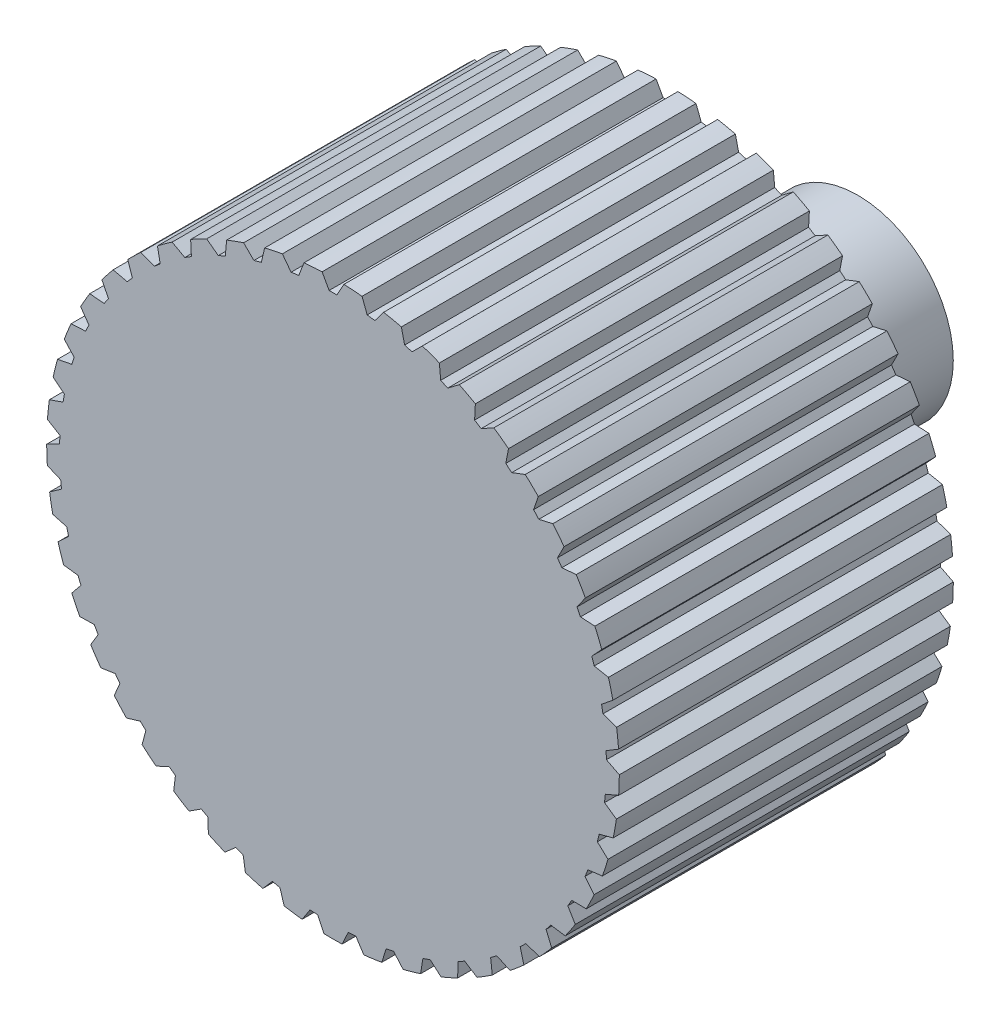
from build123d import *

# Parameters (mm, degrees)
BOSS_EXTRU_7_DEPTH = 3.5
ESQUISSE2_R        = 1
BOSS_EXTRU_8_DEPTH = 2


with BuildPart() as part:
    # Esquisse1 → Boss.-Extru.7 (new body)
    with BuildSketch(Plane.XY):
        with BuildLine():
            Line((-0.040605305, 2.865160176), (-0.114276657, 2.997822684))
            ThreePointArc((-0.114276657, 2.997822684), (-0.209269421, 2.992692151), (-0.304051754, 2.984552317))
            Line((-0.304051754, 2.984552317), (-0.35854309, 2.8429278))
            Line((-0.35854309, 2.8429278), (-0.438963363, 2.831625467))
            Line((-0.438963363, 2.831625467), (-0.530380804, 2.952743843))
            ThreePointArc((-0.530380804, 2.952743843), (-0.623735072, 2.934442802), (-0.716462144, 2.913191033))
            Line((-0.716462144, 2.913191033), (-0.750712851, 2.765361068))
            Line((-0.750712851, 2.765361068), (-0.828777499, 2.742976391))
            Line((-0.828777499, 2.742976391), (-0.936161691, 2.850193202))
            ThreePointArc((-0.936161691, 2.850193202), (-1.02606043, 2.819077862), (-1.114927414, 2.7851278))
            Line((-1.114927414, 2.7851278), (-1.12827084, 2.633969729))
            Line((-1.12827084, 2.633969729), (-1.202460424, 2.600938398))
            Line((-1.202460424, 2.600938398), (-1.323721256, 2.692166792))
            ThreePointArc((-1.323721256, 2.692166792), (-1.408414688, 2.648842779), (-1.491691889, 2.602855222))
            Line((-1.491691889, 2.602855222), (-1.483868321, 2.451311165))
            Line((-1.483868321, 2.451311165), (-1.552738824, 2.408276099))
            Line((-1.552738824, 2.408276099), (-1.685516093, 2.481740418))
            ThreePointArc((-1.685516093, 2.481740418), (-1.763355757, 2.427050983), (-1.839422279, 2.369921028))
            Line((-1.839422279, 2.369921028), (-1.810583992, 2.220940618))
            Line((-1.810583992, 2.220940618), (-1.872794929, 2.168739444))
            Line((-1.872794929, 2.168739444), (-2.014504276, 2.223009789))
            ThreePointArc((-2.014504276, 2.223009789), (-2.083975111, 2.158019401), (-2.151350406, 2.090859017))
            Line((-2.151350406, 2.090859017), (-2.102058706, 1.947341988))
            Line((-2.102058706, 1.947341988), (-2.156399211, 1.886990743))
            Line((-2.156399211, 1.886990743), (-2.304282424, 1.921010804))
            ThreePointArc((-2.304282424, 1.921010804), (-2.364032261, 1.846984426), (-2.421404945, 1.771100813))
            Line((-2.421404945, 1.771100813), (-2.352619239, 1.635840561))
            Line((-2.352619239, 1.635840561), (-2.398031635, 1.568513914))
            Line((-2.398031635, 1.568513914), (-2.549210337, 1.581621528))
            ThreePointArc((-2.549210337, 1.581621528), (-2.598076211, 1.5), (-2.644329591, 1.416870147))
            Line((-2.644329591, 1.416870147), (-2.557388713, 1.292499358))
            Line((-2.557388713, 1.292499358), (-2.592989102, 1.219507746))
            Line((-2.592989102, 1.219507746), (-2.74452077, 1.211447789))
            ThreePointArc((-2.74452077, 1.211447789), (-2.781551564, 1.12381978), (-2.815785369, 1.035061715))
            Line((-2.815785369, 1.035061715), (-2.712381526, 0.924001126))
            Line((-2.712381526, 0.924001126), (-2.737476984, 0.846765246))
            Line((-2.737476984, 0.846765246), (-2.886412228, 0.817694596))
            ThreePointArc((-2.886412228, 0.817694596), (-2.910887179, 0.725765687), (-2.932435088, 0.633106984))
            Line((-2.932435088, 0.633106984), (-2.814580917, 0.537518262))
            Line((-2.814580917, 0.537518262), (-2.828682992, 0.457541424))
            Line((-2.828682992, 0.457541424), (-2.972122955, 0.408025908))
            ThreePointArc((-2.972122955, 0.408025908), (-2.983565686, 0.31358539), (-2.992008294, 0.218829546))
            Line((-2.992008294, 0.218829546), (-2.861997693, 0.140573217))
            Line((-2.861997693, 0.140573217), (-2.864831902, 0.059412079))
            Line((-2.864831902, 0.059412079), (-2.999984689, -0.00958454))
            ThreePointArc((-2.999984689, -0.00958454), (-2.998172481, -0.10469849), (-2.993345461, -0.19970716))
            Line((-2.993345461, -0.19970716), (-2.853708938, -0.259107925))
            Line((-2.853708938, -0.259107925), (-2.845220118, -0.339873655))
            Line((-2.845220118, -0.339873655), (-2.969455134, -0.427008436))
            ThreePointArc((-2.969455134, -0.427008436), (-2.954423259, -0.520944533), (-2.936420564, -0.614356794))
            Line((-2.936420564, -0.614356794), (-2.789875986, -0.653745827))
            Line((-2.789875986, -0.653745827), (-2.770229361, -0.732544135))
            Line((-2.770229361, -0.732544135), (-2.881128513, -0.836121099))
            ThreePointArc((-2.881128513, -0.836121099), (-2.853169549, -0.927050983), (-2.822341581, -1.017048672))
            Line((-2.822341581, -1.017048672), (-2.67174127, -1.03565931))
            Line((-2.67174127, -1.03565931), (-2.641319241, -1.110956476))
            Line((-2.641319241, -1.110956476), (-2.736724002, -1.228959615))
            ThreePointArc((-2.736724002, -1.228959615), (-2.696382139, -1.31511344), (-2.653328929, -1.399944854))
            Line((-2.653328929, -1.399944854), (-2.50160415, -1.397414862))
            Line((-2.50160415, -1.397414862), (-2.460998845, -1.467745313))
            Line((-2.460998845, -1.467745313), (-2.539052272, -1.59787783))
            ThreePointArc((-2.539052272, -1.59787783), (-2.487112718, -1.67757871), (-2.432672248, -1.755592702))
            Line((-2.432672248, -1.755592702), (-2.282776151, -1.731971324))
            Line((-2.282776151, -1.731971324), (-2.232777907, -1.795966158))
            Line((-2.232777907, -1.795966158), (-2.291960777, -1.935695171))
            ThreePointArc((-2.291960777, -1.935695171), (-2.229434476, -2.007391819), (-2.164666369, -2.077069935))
            Line((-2.164666369, -2.077069935), (-2.019516511, -2.032816934))
            Line((-2.019516511, -2.032816934), (-1.961098487, -2.089230564))
            Line((-1.961098487, -2.089230564), (-2.000258873, -2.235836408))
            ThreePointArc((-2.000258873, -2.235836408), (-1.928362829, -2.298133329), (-1.854527721, -2.358119364))
            Line((-1.854527721, -2.358119364), (-1.716949278, -2.294096074))
            Line((-1.716949278, -2.294096074), (-1.651248515, -2.341830473))
            Line((-1.651248515, -2.341830473), (-1.669624205, -2.492459631))
            ThreePointArc((-1.669624205, -2.492459631), (-1.589757793, -2.544144288), (-1.5082928, -2.593270682))
            Line((-1.5082928, -2.593270682), (-1.380963581, -2.510723244))
            Line((-1.380963581, -2.510723244), (-1.309258869, -2.548849316))
            Line((-1.309258869, -2.548849316), (-1.306492201, -2.700569964))
            ThreePointArc((-1.306492201, -2.700569964), (-1.220209929, -2.740636373), (-1.132700676, -2.777946936))
            Line((-1.132700676, -2.777946936), (-1.018098999, -2.678482042))
            Line((-1.018098999, -2.678482042), (-0.941785989, -2.706257707))
            Line((-0.941785989, -2.706257707), (-0.917930812, -2.856116773))
            ThreePointArc((-0.917930812, -2.856116773), (-0.826912067, -2.883785088), (-0.735061821, -2.908553613))
            Line((-0.735061821, -2.908553613), (-0.635418278, -2.794107234))
            Line((-0.635418278, -2.794107234), (-0.555982315, -2.810991869))
            Line((-0.555982315, -2.810991869), (-0.511502945, -2.956072519))
            ThreePointArc((-0.511502945, -2.956072519), (-0.417519303, -2.970804206), (-0.323115824, -2.982548602))
            Line((-0.323115824, -2.982548602), (-0.240369863, -2.855348306))
            Line((-0.240369863, -2.855348306), (-0.159357078, -2.861013272))
            Line((-0.159357078, -2.861013272), (-0.095119254, -2.998491675))
            ThreePointArc((-0.095119254, -2.998491675), (0, -3), (0.095119254, -2.998491675))
            Line((0.095119254, -2.998491675), (0.159357078, -2.861013272))
            Line((0.159357078, -2.861013272), (0.240369863, -2.855348306))
            Line((0.240369863, -2.855348306), (0.323115824, -2.982548602))
            ThreePointArc((0.323115824, -2.982548602), (0.417519303, -2.970804206), (0.511502945, -2.956072519))
            Line((0.511502945, -2.956072519), (0.555982315, -2.810991869))
            Line((0.555982315, -2.810991869), (0.635418278, -2.794107234))
            Line((0.635418278, -2.794107234), (0.735061821, -2.908553613))
            ThreePointArc((0.735061821, -2.908553613), (0.826912067, -2.883785088), (0.917930812, -2.856116773))
            Line((0.917930812, -2.856116773), (0.941785989, -2.706257707))
            Line((0.941785989, -2.706257707), (1.018098999, -2.678482042))
            Line((1.018098999, -2.678482042), (1.132700676, -2.777946936))
            ThreePointArc((1.132700676, -2.777946936), (1.220209929, -2.740636373), (1.306492201, -2.700569964))
            Line((1.306492201, -2.700569964), (1.309258869, -2.548849316))
            Line((1.309258869, -2.548849316), (1.380963581, -2.510723244))
            Line((1.380963581, -2.510723244), (1.5082928, -2.593270682))
            ThreePointArc((1.5082928, -2.593270682), (1.589757793, -2.544144288), (1.669624205, -2.492459631))
            Line((1.669624205, -2.492459631), (1.651248515, -2.341830473))
            Line((1.651248515, -2.341830473), (1.716949278, -2.294096074))
            Line((1.716949278, -2.294096074), (1.854527721, -2.358119364))
            ThreePointArc((1.854527721, -2.358119364), (1.928362829, -2.298133329), (2.000258873, -2.235836408))
            Line((2.000258873, -2.235836408), (1.961098487, -2.089230564))
            Line((1.961098487, -2.089230564), (2.019516511, -2.032816934))
            Line((2.019516511, -2.032816934), (2.164666369, -2.077069935))
            ThreePointArc((2.164666369, -2.077069935), (2.229434476, -2.007391819), (2.291960777, -1.935695171))
            Line((2.291960777, -1.935695171), (2.232777907, -1.795966158))
            Line((2.232777907, -1.795966158), (2.282776151, -1.731971324))
            Line((2.282776151, -1.731971324), (2.432672248, -1.755592702))
            ThreePointArc((2.432672248, -1.755592702), (2.487112718, -1.67757871), (2.539052272, -1.59787783))
            Line((2.539052272, -1.59787783), (2.460998845, -1.467745313))
            Line((2.460998845, -1.467745313), (2.50160415, -1.397414862))
            Line((2.50160415, -1.397414862), (2.653328929, -1.399944854))
            ThreePointArc((2.653328929, -1.399944854), (2.696382139, -1.31511344), (2.736724002, -1.228959615))
            Line((2.736724002, -1.228959615), (2.641319241, -1.110956476))
            Line((2.641319241, -1.110956476), (2.67174127, -1.03565931))
            Line((2.67174127, -1.03565931), (2.822341581, -1.017048672))
            ThreePointArc((2.822341581, -1.017048672), (2.853169549, -0.927050983), (2.881128513, -0.836121099))
            Line((2.881128513, -0.836121099), (2.770229361, -0.732544135))
            Line((2.770229361, -0.732544135), (2.789875986, -0.653745827))
            Line((2.789875986, -0.653745827), (2.936420564, -0.614356794))
            ThreePointArc((2.936420564, -0.614356794), (2.954423259, -0.520944533), (2.969455134, -0.427008436))
            Line((2.969455134, -0.427008436), (2.845220118, -0.339873655))
            Line((2.845220118, -0.339873655), (2.853708938, -0.259107925))
            Line((2.853708938, -0.259107925), (2.993345461, -0.19970716))
            ThreePointArc((2.993345461, -0.19970716), (2.998172481, -0.10469849), (2.999984689, -0.00958454))
            Line((2.999984689, -0.00958454), (2.864831902, 0.059412079))
            Line((2.864831902, 0.059412079), (2.861997693, 0.140573217))
            Line((2.861997693, 0.140573217), (2.992008294, 0.218829546))
            ThreePointArc((2.992008294, 0.218829546), (2.983565686, 0.31358539), (2.972122955, 0.408025908))
            Line((2.972122955, 0.408025908), (2.828682992, 0.457541424))
            Line((2.828682992, 0.457541424), (2.814580917, 0.537518262))
            Line((2.814580917, 0.537518262), (2.932435088, 0.633106984))
            ThreePointArc((2.932435088, 0.633106984), (2.910887179, 0.725765687), (2.886412228, 0.817694596))
            Line((2.886412228, 0.817694596), (2.737476984, 0.846765246))
            Line((2.737476984, 0.846765246), (2.712381526, 0.924001126))
            Line((2.712381526, 0.924001126), (2.815785369, 1.035061715))
            ThreePointArc((2.815785369, 1.035061715), (2.781551564, 1.12381978), (2.74452077, 1.211447789))
            Line((2.74452077, 1.211447789), (2.592989102, 1.219507746))
            Line((2.592989102, 1.219507746), (2.557388713, 1.292499358))
            Line((2.557388713, 1.292499358), (2.644329591, 1.416870147))
            ThreePointArc((2.644329591, 1.416870147), (2.598076211, 1.5), (2.549210337, 1.581621528))
            Line((2.549210337, 1.581621528), (2.398031635, 1.568513914))
            Line((2.398031635, 1.568513914), (2.352619239, 1.635840561))
            Line((2.352619239, 1.635840561), (2.421404945, 1.771100813))
            ThreePointArc((2.421404945, 1.771100813), (2.364032261, 1.846984426), (2.304282424, 1.921010804))
            Line((2.304282424, 1.921010804), (2.156399211, 1.886990743))
            Line((2.156399211, 1.886990743), (2.102058706, 1.947341988))
            Line((2.102058706, 1.947341988), (2.151350406, 2.090859017))
            ThreePointArc((2.151350406, 2.090859017), (2.083975111, 2.158019401), (2.014504276, 2.223009789))
            Line((2.014504276, 2.223009789), (1.872794929, 2.168739444))
            Line((1.872794929, 2.168739444), (1.810583992, 2.220940618))
            Line((1.810583992, 2.220940618), (1.839422279, 2.369921028))
            ThreePointArc((1.839422279, 2.369921028), (1.763355757, 2.427050983), (1.685516093, 2.481740418))
            Line((1.685516093, 2.481740418), (1.552738824, 2.408276099))
            Line((1.552738824, 2.408276099), (1.483868321, 2.451311165))
            Line((1.483868321, 2.451311165), (1.491691889, 2.602855222))
            ThreePointArc((1.491691889, 2.602855222), (1.408414688, 2.648842779), (1.323721256, 2.692166792))
            Line((1.323721256, 2.692166792), (1.202460424, 2.600938398))
            Line((1.202460424, 2.600938398), (1.12827084, 2.633969729))
            Line((1.12827084, 2.633969729), (1.114927414, 2.7851278))
            ThreePointArc((1.114927414, 2.7851278), (1.02606043, 2.819077862), (0.936161691, 2.850193202))
            Line((0.936161691, 2.850193202), (0.828777499, 2.742976391))
            Line((0.828777499, 2.742976391), (0.750712851, 2.765361068))
            Line((0.750712851, 2.765361068), (0.716462144, 2.913191033))
            ThreePointArc((0.716462144, 2.913191033), (0.623735072, 2.934442802), (0.530380804, 2.952743843))
            Line((0.530380804, 2.952743843), (0.438963363, 2.831625467))
            Line((0.438963363, 2.831625467), (0.35854309, 2.8429278))
            Line((0.35854309, 2.8429278), (0.304051754, 2.984552317))
            ThreePointArc((0.304051754, 2.984552317), (0.209269421, 2.992692151), (0.114276657, 2.997822684))
            Line((0.114276657, 2.997822684), (0.040605305, 2.865160176))
            Line((0.040605305, 2.865160176), (-0.040605305, 2.865160176))
        make_face()
    extrude(amount=BOSS_EXTRU_7_DEPTH)

    # Esquisse2 → Boss.-Extru.8 (add)
    with BuildSketch(Plane(origin=(0, 0, 0), x_dir=(-1, 0, 0), z_dir=(0, 0, -1))):
        with Locations(Location((0, 0, 0), (0, 0, 180))):
            Circle(ESQUISSE2_R)
    extrude(amount=BOSS_EXTRU_8_DEPTH)


solid = part.part
